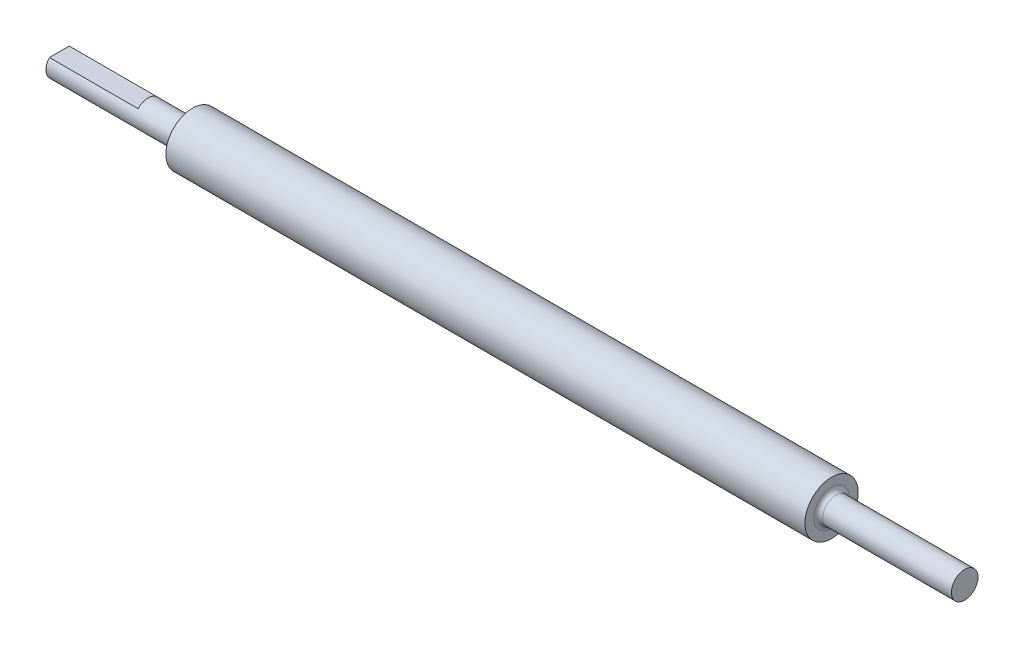
from build123d import *

# Parameters (mm, degrees)
FILLET1_R          = 0.5
CUT_EXTRUDE1_DEPTH = 10


with BuildPart() as part:
    # Sketch1 → Revolve1 (revolve)
    with BuildSketch(Plane(origin=(0, 0, 0), x_dir=(1, 0, 0), z_dir=(0, 1, 0)), mode=Mode.PRIVATE) as revolve1_sk:
        Polygon((-29.558969675, -16.48093475), (72.441030325, -16.48093475), (72.441030325, -14.98093475), (57.441030325, -14.98093475), (57.441030325, -13.48093475), (-14.558969675, -13.48093475), (-14.558969675, -14.98093475), (-29.558969675, -14.98093475), align=None)
    revolve(revolve1_sk.sketch.rotate(Axis((-29.558969675, 0, 16.48093475), (1, 0, 0)), 180), axis=Axis((-29.558969675, 0, 16.48093475), (1, 0, 0)))

    # Fillet1
    fillet1_edges = [part.edges().sort_by_distance(p)[0] for p in [
        (57.441030325, 0, 14.98093475),
        (-14.558969675, 0, 14.98093475),
    ]]
    fillet(fillet1_edges, radius=FILLET1_R)

    # Sketch2 → Cut-Extrude1 (cut)
    with BuildSketch(Plane.ZY.offset(29.558969675)):
        with BuildLine():
            Line((15.362900761, 1), (17.598968739, 1))
            ThreePointArc((17.598968739, 1), (16.48093475, 1.5), (15.362900761, 1))
        make_face()
    extrude(amount=-CUT_EXTRUDE1_DEPTH, mode=Mode.SUBTRACT)


solid = part.part
